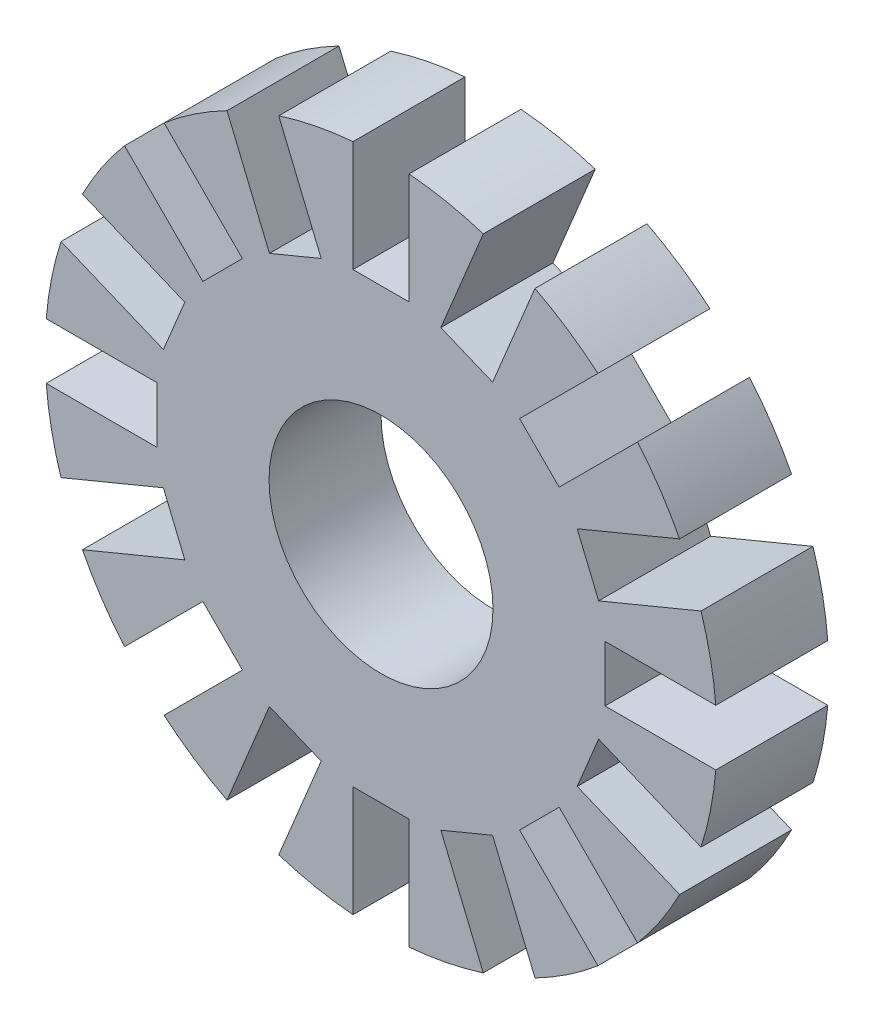
from build123d import *

# Parameters (mm, degrees)
BOSS_EXTRUDE1_DEPTH      = 3.175
BOSS_EXTRUDE1_DEPTH_BACK = 3.175
SKETCH1_R                = 6.35


with BuildPart() as part:
    # Sketch1 → Boss-Extrude1 (new, two sides: drawn at the far end of the back side and taken through both)
    with BuildSketch(Plane.XY.offset(-BOSS_EXTRUDE1_DEPTH_BACK)):
        with BuildLine():
            ThreePointArc((5.798103615, 18.146197797), (3.716470634, 18.683959592), (1.5875, 18.98373893))
            Line((1.5875, 18.98373893), (1.5875, 12.7))
            Line((1.5875, 12.7), (-1.5875, 12.7))
            Line((-1.5875, 12.7), (-1.5875, 18.98373893))
            ThreePointArc((-1.5875, 18.98373893), (-3.716470634, 18.683959592), (-5.798103615, 18.146197797))
            Line((-5.798103615, 18.146197797), (-3.393420833, 12.340780012))
            Line((-3.393420833, 12.340780012), (-6.326738349, 11.125760114))
            Line((-6.326738349, 11.125760114), (-8.731421131, 16.931177899))
            ThreePointArc((-8.731421131, 16.931177899), (-10.583612939, 15.839496114), (-12.300998514, 14.546062545))
            Line((-12.300998514, 14.546062545), (-7.857724106, 10.102788136))
            Line((-7.857724106, 10.102788136), (-10.102788136, 7.857724106))
            Line((-10.102788136, 7.857724106), (-14.546062545, 12.300998514))
            ThreePointArc((-14.546062545, 12.300998514), (-15.839496114, 10.583612939), (-16.931177899, 8.731421131))
            Line((-16.931177899, 8.731421131), (-11.125760114, 6.326738349))
            Line((-11.125760114, 6.326738349), (-12.340780012, 3.393420833))
            Line((-12.340780012, 3.393420833), (-18.146197797, 5.798103615))
            ThreePointArc((-18.146197797, 5.798103615), (-18.683959592, 3.716470634), (-18.98373893, 1.5875))
            Line((-18.98373893, 1.5875), (-12.7, 1.5875))
            Line((-12.7, 1.5875), (-12.7, -1.5875))
            Line((-12.7, -1.5875), (-18.98373893, -1.5875))
            ThreePointArc((-18.98373893, -1.5875), (-18.683959592, -3.716470634), (-18.146197797, -5.798103615))
            Line((-18.146197797, -5.798103615), (-12.340780012, -3.393420833))
            Line((-12.340780012, -3.393420833), (-11.125760114, -6.326738349))
            Line((-11.125760114, -6.326738349), (-16.931177899, -8.731421131))
            ThreePointArc((-16.931177899, -8.731421131), (-15.839496114, -10.583612939), (-14.546062545, -12.300998514))
            Line((-14.546062545, -12.300998514), (-10.102788136, -7.857724106))
            Line((-10.102788136, -7.857724106), (-7.857724106, -10.102788136))
            Line((-7.857724106, -10.102788136), (-12.300998514, -14.546062545))
            ThreePointArc((-12.300998514, -14.546062545), (-10.583612939, -15.839496114), (-8.731421131, -16.931177899))
            Line((-8.731421131, -16.931177899), (-6.326738349, -11.125760114))
            Line((-6.326738349, -11.125760114), (-3.393420833, -12.340780012))
            Line((-3.393420833, -12.340780012), (-5.798103615, -18.146197797))
            ThreePointArc((-5.798103615, -18.146197797), (-3.716470634, -18.683959592), (-1.5875, -18.98373893))
            Line((-1.5875, -18.98373893), (-1.5875, -12.7))
            Line((-1.5875, -12.7), (1.5875, -12.7))
            Line((1.5875, -12.7), (1.5875, -18.98373893))
            ThreePointArc((1.5875, -18.98373893), (3.716470634, -18.683959592), (5.798103615, -18.146197797))
            Line((5.798103615, -18.146197797), (3.393420833, -12.340780012))
            Line((3.393420833, -12.340780012), (6.326738349, -11.125760114))
            Line((6.326738349, -11.125760114), (8.731421131, -16.931177899))
            ThreePointArc((8.731421131, -16.931177899), (10.583612939, -15.839496114), (12.300998514, -14.546062545))
            Line((12.300998514, -14.546062545), (7.857724106, -10.102788136))
            Line((7.857724106, -10.102788136), (10.102788136, -7.857724106))
            Line((10.102788136, -7.857724106), (14.546062545, -12.300998514))
            ThreePointArc((14.546062545, -12.300998514), (15.839496114, -10.583612939), (16.931177899, -8.731421131))
            Line((16.931177899, -8.731421131), (11.125760114, -6.326738349))
            Line((11.125760114, -6.326738349), (12.340780012, -3.393420833))
            Line((12.340780012, -3.393420833), (18.146197797, -5.798103615))
            ThreePointArc((18.146197797, -5.798103615), (18.683959592, -3.716470634), (18.98373893, -1.5875))
            Line((18.98373893, -1.5875), (12.7, -1.5875))
            Line((12.7, -1.5875), (12.7, 1.5875))
            Line((12.7, 1.5875), (18.98373893, 1.5875))
            ThreePointArc((18.98373893, 1.5875), (18.683959592, 3.716470634), (18.146197797, 5.798103615))
            Line((18.146197797, 5.798103615), (12.340780012, 3.393420833))
            Line((12.340780012, 3.393420833), (11.125760114, 6.326738349))
            Line((11.125760114, 6.326738349), (16.931177899, 8.731421131))
            ThreePointArc((16.931177899, 8.731421131), (15.839496114, 10.583612939), (14.546062545, 12.300998514))
            Line((14.546062545, 12.300998514), (10.102788136, 7.857724106))
            Line((10.102788136, 7.857724106), (7.857724106, 10.102788136))
            Line((7.857724106, 10.102788136), (12.300998514, 14.546062545))
            ThreePointArc((12.300998514, 14.546062545), (10.583612939, 15.839496114), (8.731421131, 16.931177899))
            Line((8.731421131, 16.931177899), (6.326738349, 11.125760114))
            Line((6.326738349, 11.125760114), (3.393420833, 12.340780012))
            Line((3.393420833, 12.340780012), (5.798103615, 18.146197797))
        make_face()
        Circle(SKETCH1_R, mode=Mode.SUBTRACT)
    extrude(amount=BOSS_EXTRUDE1_DEPTH + BOSS_EXTRUDE1_DEPTH_BACK)


solid = part.part
